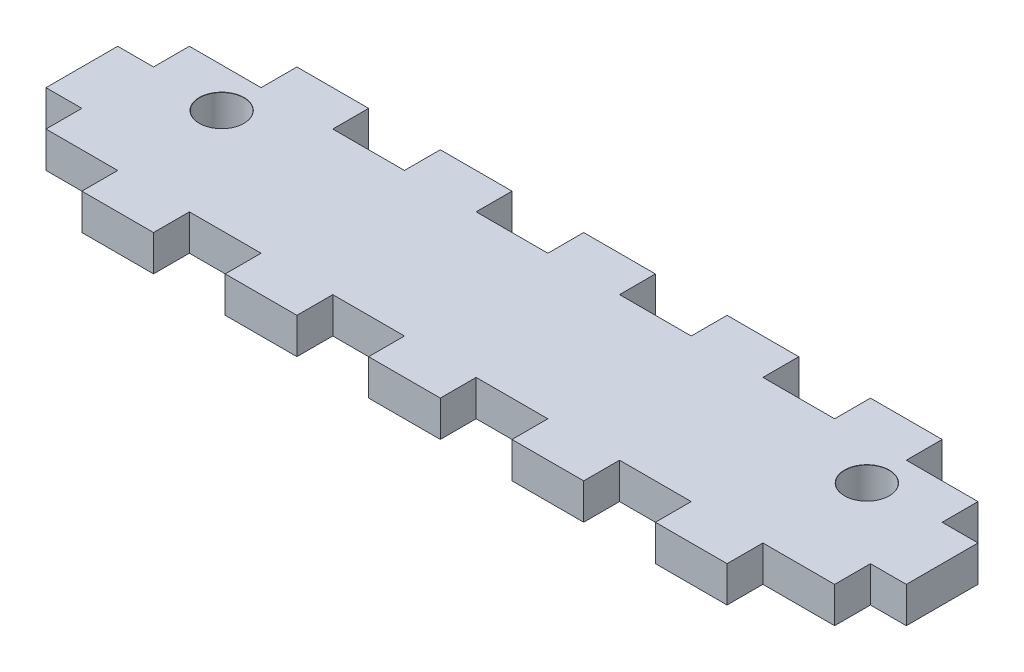
from build123d import *

# Parameters (mm, degrees)
BOSS_EXTRUDE1_DEPTH                  = 2.5
F_6_2_6_2_DIAMETER_HOLE1_D           = 6.2
F_6_2_6_2_DIAMETER_HOLE1_CSINK_D     = 6.25
F_6_2_6_2_DIAMETER_HOLE1_CSINK_ANGLE = 90


with BuildPart() as part:
    # Sketch1 → Boss-Extrude1 (new, symmetric)
    with BuildSketch(Plane(origin=(0, 0, 0), x_dir=(1, 0, 0), z_dir=(0, 1, 0))):
        Polygon((45, 15), (35, 15), (35, 10), (25, 10), (25, 15), (15, 15), (15, 10), (5, 10), (5, 15), (-5, 15), (-5, 10), (-15, 10), (-15, 15), (-25, 15), (-25, 10), (-35, 10), (-35, 15), (-45, 15), (-45, 10), (-55, 10), (-55, 5), (-60, 5), (-60, -5), (-55, -5), (-55, -10), (-45, -10), (-45, -15), (-35, -15), (-35, -10), (-25, -10), (-25, -15), (-15, -15), (-15, -10), (-5, -10), (-5, -15), (5, -15), (5, -10), (15, -10), (15, -15), (25, -15), (25, -10), (35, -10), (35, -15), (45, -15), (45, -10), (55, -10), (55, -5), (60, -5), (60, 5), (55, 5), (55, 10), (45, 10), align=None)
    extrude(amount=BOSS_EXTRUDE1_DEPTH, both=True)

    # Ø6.2 (6.2) Diameter Hole1 (through all)
    with Locations(Plane(origin=(0, 2.5, 0), x_dir=(1, 0, 0), z_dir=(0, 1, 0))):
        with Locations((-45, 4.5), (45, 4.5)):
            CounterSinkHole(F_6_2_6_2_DIAMETER_HOLE1_D / 2, F_6_2_6_2_DIAMETER_HOLE1_CSINK_D / 2, counter_sink_angle=F_6_2_6_2_DIAMETER_HOLE1_CSINK_ANGLE)


solid = part.part
